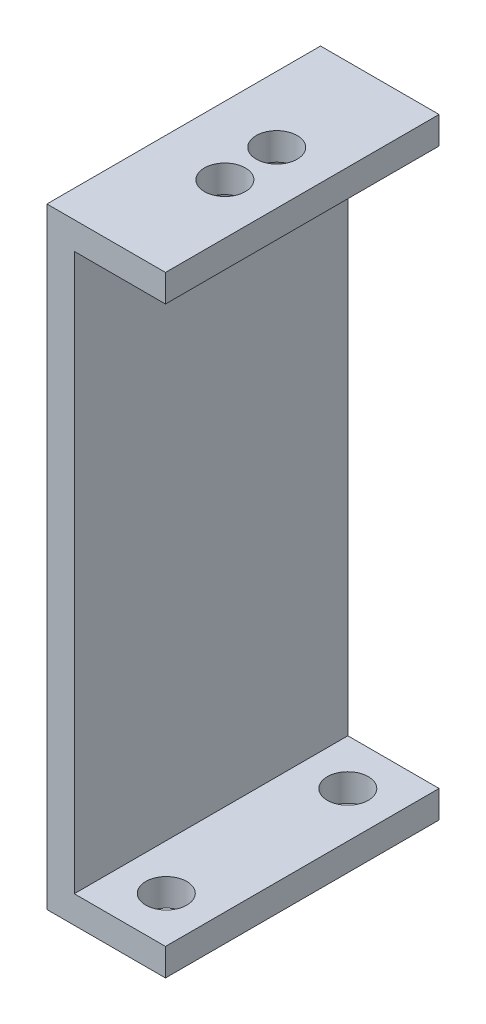
from build123d import *

# Parameters (mm, degrees)
SKETCH1_W                = 13
SKETCH1_H                = 67
BOSS_EXTRUDE1_DEPTH      = 30
SKETCH2_W                = 67.456445976
SKETCH2_H                = 61
CUT_EXTRUDE1_DEPTH       = 10
M4_CLEARANCE_HOLE3_D     = 4.5
M4_CLEARANCE_HOLE3_DEPTH = 6
M4_CLEARANCE_HOLE3_TIP   = 1.351936393
M4_CLEARANCE_HOLE1_D     = 4.5
M4_CLEARANCE_HOLE1_DEPTH = 6
M4_CLEARANCE_HOLE1_TIP   = 1.351936393
M4_CLEARANCE_HOLE2_D     = 4.5
M4_CLEARANCE_HOLE2_DEPTH = 6
M4_CLEARANCE_HOLE2_TIP   = 1.351936393


with BuildPart() as part:
    # Sketch1 → Boss-Extrude1 (new body)
    with BuildSketch(Plane.XY):
        Rectangle(SKETCH1_W, SKETCH1_H)
    extrude(amount=BOSS_EXTRUDE1_DEPTH)

    # Sketch2 → Cut-Extrude1 (cut)
    with BuildSketch(Plane(origin=(6.5, 0, 0), x_dir=(0, 0, -1), z_dir=(1, 0, 0))):
        with Locations((-11.6230653, 0)):
            Rectangle(SKETCH2_W, SKETCH2_H)
    extrude(amount=-CUT_EXTRUDE1_DEPTH, mode=Mode.SUBTRACT)

    # M4 Clearance Hole3
    with Locations(Plane(origin=(0, 33.5, 0), x_dir=(1, 0, 0), z_dir=(0, 1, 0))):
        with Locations((0.724225785, -12.024273001)):
            Hole(M4_CLEARANCE_HOLE3_D / 2, depth=M4_CLEARANCE_HOLE3_DEPTH)
            with Locations((0, 0, -(M4_CLEARANCE_HOLE3_DEPTH + M4_CLEARANCE_HOLE3_TIP / 2))):  # 118° drill point
                Cone(0, M4_CLEARANCE_HOLE3_D / 2, M4_CLEARANCE_HOLE3_TIP, mode=Mode.SUBTRACT)

    # M4 Clearance Hole1
    with Locations(Plane(origin=(0, -30.5, 0), x_dir=(1, 0, 0), z_dir=(0, 1, 0))):
        with Locations((1.5, -5.008015198), (1.5, -24.910664678)):
            Hole(M4_CLEARANCE_HOLE1_D / 2, depth=M4_CLEARANCE_HOLE1_DEPTH)
            with Locations((0, 0, -(M4_CLEARANCE_HOLE1_DEPTH + M4_CLEARANCE_HOLE1_TIP / 2))):  # 118° drill point
                Cone(0, M4_CLEARANCE_HOLE1_D / 2, M4_CLEARANCE_HOLE1_TIP, mode=Mode.SUBTRACT)

    # M4 Clearance Hole2
    with Locations(Plane(origin=(0, 33.5, 0), x_dir=(1, 0, 0), z_dir=(0, 1, 0))):
        with Locations((0.958202429, -17.944695077)):
            Hole(M4_CLEARANCE_HOLE2_D / 2, depth=M4_CLEARANCE_HOLE2_DEPTH)
            with Locations((0, 0, -(M4_CLEARANCE_HOLE2_DEPTH + M4_CLEARANCE_HOLE2_TIP / 2))):  # 118° drill point
                Cone(0, M4_CLEARANCE_HOLE2_D / 2, M4_CLEARANCE_HOLE2_TIP, mode=Mode.SUBTRACT)


solid = part.part
